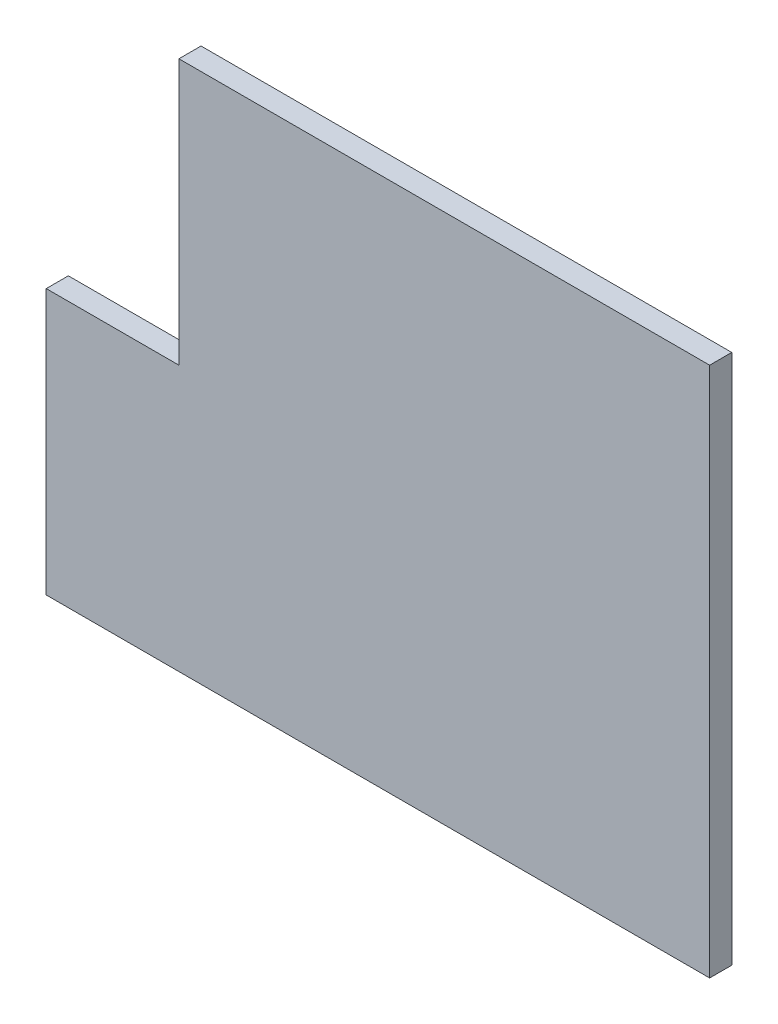
from build123d import *

# Parameters (mm, degrees)
SKETCH1_W           = 95.25
SKETCH1_H           = 76.2
BOSS_EXTRUDE1_DEPTH = 1.5875
SKETCH2_W           = 19.05
SKETCH2_H           = 38.1
CUT_EXTRUDE1_DEPTH  = 3.175


with BuildPart() as part:
    # Sketch1 → Boss-Extrude1 (new, symmetric)
    with BuildSketch(Plane.XY):
        Rectangle(SKETCH1_W, SKETCH1_H)
    extrude(amount=BOSS_EXTRUDE1_DEPTH, both=True)

    # Sketch2 → Cut-Extrude1 (cut)
    with BuildSketch(Plane.XY.offset(1.5875)):
        with Locations((-38.1, 19.05)):
            Rectangle(SKETCH2_W, SKETCH2_H)
    extrude(amount=-CUT_EXTRUDE1_DEPTH, mode=Mode.SUBTRACT)


solid = part.part
